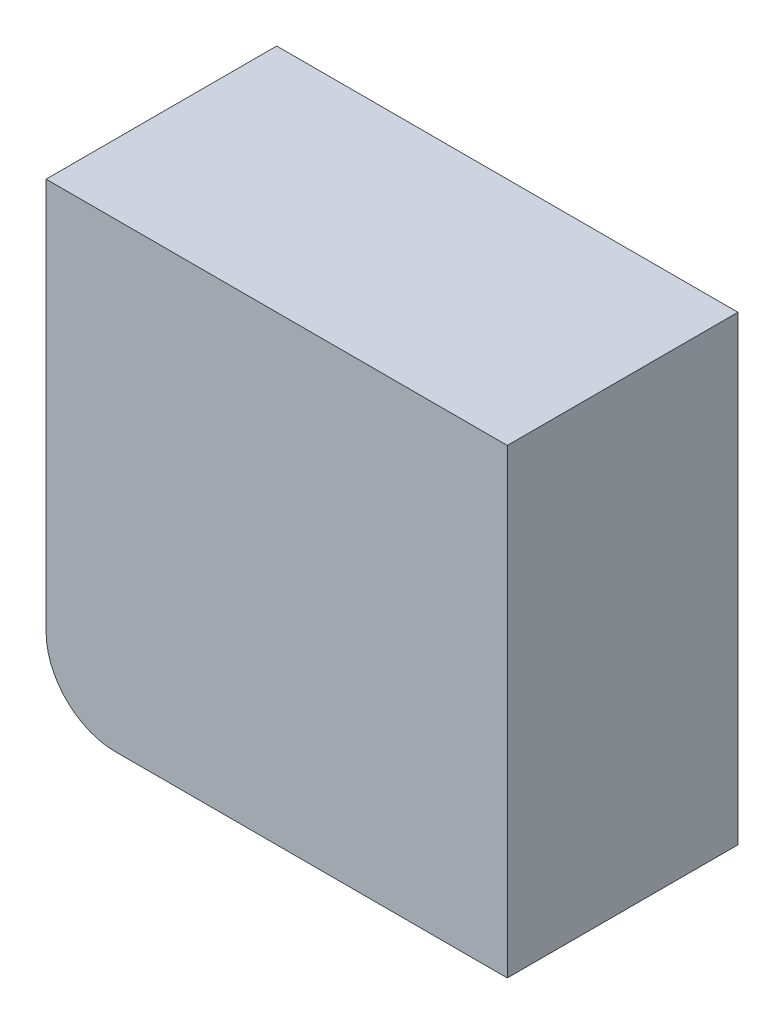
from build123d import *

# Parameters (mm, degrees)
SKETCH_1_W    = 20
SKETCH_1_H    = 20
BASEBOX_DEPTH = 10
FACEFILLET_R  = 3


with BuildPart() as part:
    # 草图1 → BaseBox (new body)
    with BuildSketch(Plane.XY):
        with Locations((10, 10)):
            Rectangle(SKETCH_1_W, SKETCH_1_H)
    extrude(amount=BASEBOX_DEPTH)

    # FaceFillet
    facefillet_edges = [part.edges().sort_by_distance(p)[0] for p in [
        (0, 0, 5),
    ]]
    fillet(facefillet_edges, radius=FACEFILLET_R)


solid = part.part
